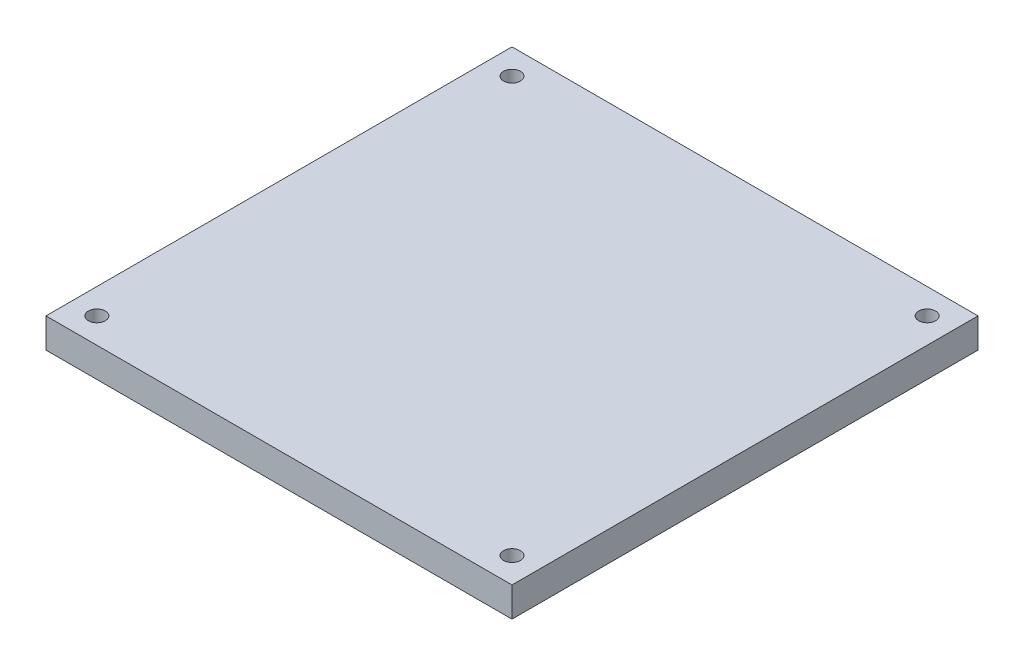
from build123d import *

# Parameters (mm, degrees)
ESQUISSE1_W             = 110
ESQUISSE1_H             = 110
BOSS_EXTRU_1_DEPTH      = 7
ESQUISSE4_R             = 2
ENL_V_MAT_EXTRU_2_DEPTH = 115.64981483


with BuildPart() as part:
    # Esquisse1 → Boss.-Extru.1 (new body)
    with BuildSketch(Plane(origin=(0, 0, 0), x_dir=(1, 0, 0), z_dir=(0, 1, 0))):
        with Locations((28.47832347, -23.274833448)):
            Rectangle(ESQUISSE1_W, ESQUISSE1_H)
    extrude(amount=BOSS_EXTRU_1_DEPTH)

    # Esquisse4 → Enlèv. mat.-Extru.2 (cut, through all)
    with BuildSketch(Plane(origin=(0, 7, 0), x_dir=(1, 0, 0), z_dir=(0, 1, 0))):
        with Locations(Location((-20.52167653, -72.274833448, 0), (0, 0, 270))):
            Circle(ESQUISSE4_R)
        with Locations(Location((-20.52167653, 25.725166552, 0), (0, 0, 270))):
            Circle(ESQUISSE4_R)
        with Locations(Location((77.47832347, 25.725166552, 0), (0, 0, 270))):
            Circle(ESQUISSE4_R)
        with Locations(Location((77.47832347, -72.274833448, 0), (0, 0, 270))):
            Circle(ESQUISSE4_R)
    extrude(amount=-ENL_V_MAT_EXTRU_2_DEPTH, mode=Mode.SUBTRACT)


solid = part.part
